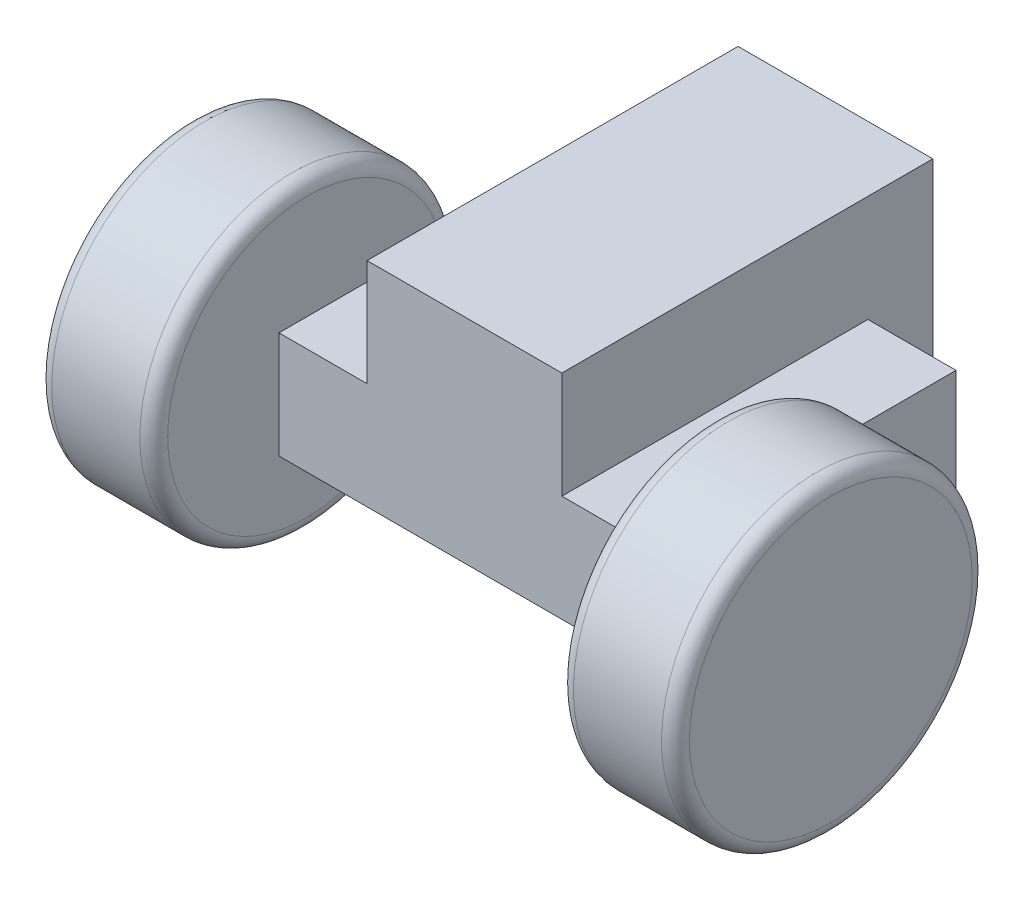
from build123d import *

# Parameters (mm, degrees)
SKETCH2_W           = 42
SKETCH2_H           = 80
BOSS_EXTRUDE1_DEPTH = 46
SKETCH3_W           = 66
SKETCH3_H           = 23
BOSS_EXTRUDE2_DEPTH = 19
SKETCH4_R           = 5
BOSS_EXTRUDE3_DEPTH = 4
SKETCH5_R           = 33.5
BOSS_EXTRUDE4_DEPTH = 25
SKETCH6_W           = 66
SKETCH6_H           = 23
BOSS_EXTRUDE5_DEPTH = 19
BOSS_EXTRUDE6_START = 4
SKETCH8_R           = 5
BOSS_EXTRUDE6_DEPTH = 4
SKETCH10_R          = 33
BOSS_EXTRUDE7_DEPTH = 25
FILLET2_R           = 3


with BuildPart() as part:
    # Sketch2 → Boss-Extrude1 (new body)
    with BuildSketch(Plane(origin=(0, 0, 0), x_dir=(1, 0, 0), z_dir=(0, 1, 0))):
        with Locations((55.96969697, 0.151515152)):
            Rectangle(SKETCH2_W, SKETCH2_H)
    extrude(amount=BOSS_EXTRUDE1_DEPTH)

    # Sketch3 → Boss-Extrude2 (add)
    with BuildSketch(Plane(origin=(76.96969697, 0, 0), x_dir=(0, 0, -1), z_dir=(1, 0, 0))):
        with Locations((-6.848484848, 11.5)):
            Rectangle(SKETCH3_W, SKETCH3_H)
    extrude(amount=BOSS_EXTRUDE2_DEPTH)

    # Sketch4 → Boss-Extrude3 (add)
    with BuildSketch(Plane(origin=(95.96969697, 0, 0), x_dir=(0, 0, -1), z_dir=(1, 0, 0))):
        with Locations(Location((-29.848484848, 11.5, 0), (0, 0, 180))):
            Circle(SKETCH4_R)
    extrude(amount=BOSS_EXTRUDE3_DEPTH)

    # Sketch5 → Boss-Extrude4 (add)
    with BuildSketch(Plane(origin=(99.96969697, 0, 0), x_dir=(0, 0, -1), z_dir=(1, 0, 0))):
        with Locations((-29.848484848, 11.5)):
            Circle(SKETCH5_R)
    extrude(amount=BOSS_EXTRUDE4_DEPTH)

    # Sketch6 → Boss-Extrude5 (add)
    with BuildSketch(Plane.ZY.offset(-34.96969697)):
        with Locations((6.848484848, 11.5)):
            Rectangle(SKETCH6_W, SKETCH6_H)
    extrude(amount=BOSS_EXTRUDE5_DEPTH)

    # Sketch8 → Boss-Extrude6 (add)
    with BuildSketch(Plane.ZY.offset(-15.96969697).offset(BOSS_EXTRUDE6_START)):
        with Locations((29.848484848, 11.5)):
            Circle(SKETCH8_R)
    extrude(amount=-BOSS_EXTRUDE6_DEPTH)

    # Sketch10 → Boss-Extrude7 (add)
    with BuildSketch(Plane.ZY.offset(-11.96969697)):
        with Locations((29.848484848, 11.5)):
            Circle(SKETCH10_R)
    extrude(amount=BOSS_EXTRUDE7_DEPTH)

    # Fillet2
    fillet2_edges = [part.edges().sort_by_distance(p)[0] for p in [
        (99.96969697, 11.5, 63.348484848),
        (124.96969697, 11.5, 63.348484848),
        (11.96969697, 11.5, -3.151515152),
        (-13.03030303, 11.5, -3.151515152),
    ]]
    fillet(fillet2_edges, radius=FILLET2_R)


solid = part.part
